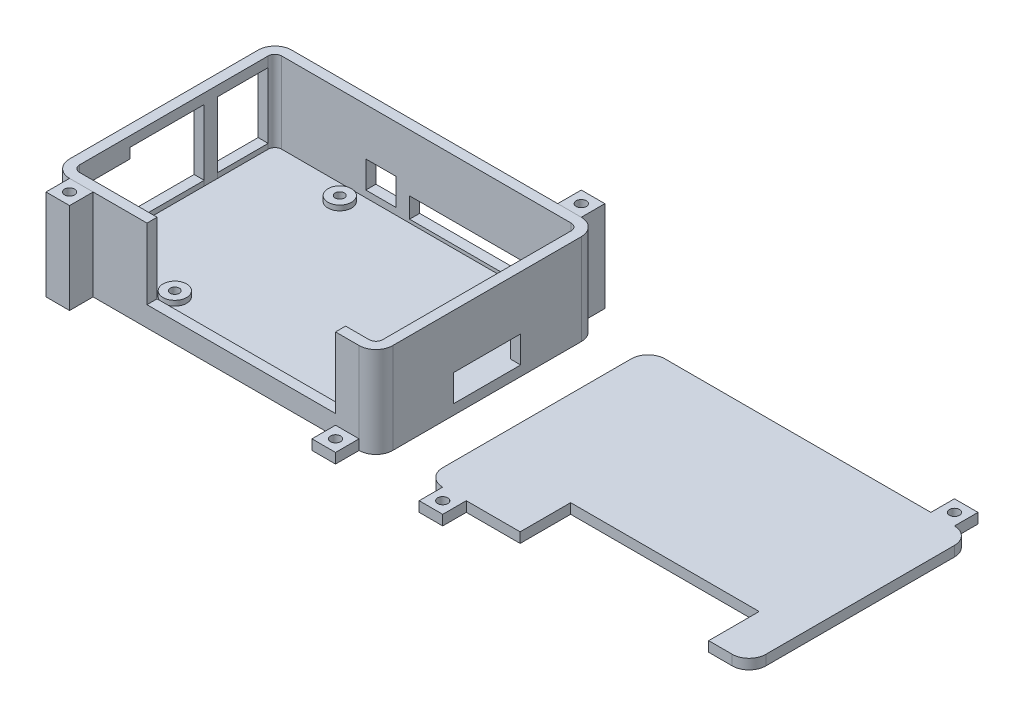
from build123d import *

# Parameters (mm, degrees)
EXTRUIR_L_MINA1_DEPTH      = 24
SALIENTE_EXTRUIR1_START    = 3
SALIENTE_EXTRUIR1_DEPTH    = 3
CORTAR_EXTRUIR1_REACH      = 106.312
CROQUIS4_W                 = 15
CROQUIS4_H                 = 21
CORTAR_EXTRUIR2_REACH      = 87.065
CROQUIS5_W                 = 56
CROQUIS5_H                 = 21
CORTAR_EXTRUIR3_REACH      = 87.065
CROQUIS7_W                 = 41
CROQUIS7_H                 = 6
CROQUIS7_W_2               = 9
CROQUIS7_H_2               = 8
CROQUIS8_W                 = 7
CROQUIS8_H                 = 7
SALIENTE_EXTRUIR5_DEPTH    = 27
SALIENTE_EXTRUIR5_2_DEPTH  = 27
CROQUIS10_R                = 1.5
CORTAR_EXTRUIR4_DEPTH      = 20
CROQUIS11_R                = 1.5
SALIENTE_EXTRUIR6_DEPTH    = 3
CROQUIS12_W                = 15
CROQUIS12_H                = 1.5
SALIENTE_EXTRUIR7_DEPTH    = 3
CROQUIS12_W_2              = 37
SALIENTE_EXTRUIR7_2_DEPTH  = 3
CROQUIS13_R                = 3.5
CROQUIS13_R_2              = 1.35
SALIENTE_EXTRUIR8_DEPTH    = 1.5
CORTAR_EXTRUIR5_DEPTH      = 2
CORTAR_EXTRUIR5_DEPTH_BACK = 166.548420234
CROQUIS14_R                = 1.35
CROQUIS15_W                = 56
CROQUIS15_H                = 15
CORTAR_EXTRUIR6_DEPTH      = 167.009877543
CROQUIS16_W                = 7
CROQUIS16_H                = 7
CROQUIS16_R                = 1.5
SALIENTE_EXTRUIR9_DEPTH    = 3
CROQUIS17_W                = 20
CROQUIS17_H                = 8
CORTAR_EXTRUIR7_DEPTH      = 3


with BuildPart() as part:
    # Croquis1 → Extruir-Lámina1 (new body)
    with BuildSketch(Plane(origin=(0, 0, 0), x_dir=(1, 0, 0), z_dir=(0, 1, 0))):
        with BuildLine():
            Line((-48, 28), (-48, -28))
            ThreePointArc((-48, -28), (-46.535533906, -31.535533906), (-43, -33))
            Line((-43, -33), (43, -33))
            ThreePointArc((43, -33), (46.535533906, -31.535533906), (48, -28))
            Line((48, -28), (48, 28))
            ThreePointArc((48, 28), (46.535533906, 31.535533906), (43, 33))
            Line((43, 33), (-43, 33))
            ThreePointArc((-43, 33), (-46.535533906, 31.535533906), (-48, 28))
        make_face()
        with BuildLine():
            Line((-45, 28), (-45, -28))
            ThreePointArc((-45, -28), (-44.414213562, -29.414213562), (-43, -30))
            Line((-43, -30), (43, -30))
            ThreePointArc((43, -30), (44.414213562, -29.414213562), (45, -28))
            Line((45, -28), (45, 28))
            ThreePointArc((45, 28), (44.414213562, 29.414213562), (43, 30))
            Line((43, 30), (-43, 30))
            ThreePointArc((-43, 30), (-44.414213562, 29.414213562), (-45, 28))
        make_face(mode=Mode.SUBTRACT)
    extrude(amount=EXTRUIR_L_MINA1_DEPTH)

    # Croquis3 → Saliente-Extruir1 (add)
    with BuildSketch(Plane.XZ.offset(SALIENTE_EXTRUIR1_START)):
        with BuildLine():
            Line((-43, 33), (43, 33))
            ThreePointArc((43, 33), (46.535533906, 31.535533906), (48, 28))
            Line((48, 28), (48, -28))
            ThreePointArc((48, -28), (46.535533906, -31.535533906), (43, -33))
            Line((43, -33), (-43, -33))
            ThreePointArc((-43, -33), (-46.535533906, -31.535533906), (-48, -28))
            Line((-48, -28), (-48, 28))
            ThreePointArc((-48, 28), (-46.535533906, 31.535533906), (-43, 33))
        make_face()
    extrude(amount=-SALIENTE_EXTRUIR1_DEPTH)

    # Croquis4 → Cortar-Extruir1 (cut, up to next)
    with BuildSketch(Plane.ZY.offset(48), mode=Mode.PRIVATE) as cortar_extruir1_sk1:
        Polygon((28, 0), (28, 18), (13, 18), (13, 21), (-9, 21), (-9, 0), align=None)
    cortar_extruir1_tool1 = extrude(cortar_extruir1_sk1.sketch, amount=-CORTAR_EXTRUIR1_REACH, mode=Mode.PRIVATE) & part.part
    # Croquis4 → Cortar-Extruir1 (cut, up to next)
    with BuildSketch(Plane.ZY.offset(48), mode=Mode.PRIVATE) as cortar_extruir1_sk2:
        with Locations((-20.5, 10.5)):
            Rectangle(CROQUIS4_W, CROQUIS4_H)
    cortar_extruir1_tool2 = extrude(cortar_extruir1_sk2.sketch, amount=-CORTAR_EXTRUIR1_REACH, mode=Mode.PRIVATE) & part.part
    add(cortar_extruir1_tool1.solids().sort_by_distance((-48, 9.946721, 8.82377))[0], mode=Mode.SUBTRACT)
    add(cortar_extruir1_tool2.solids().sort_by_distance((-48, 10.5, -20.5))[0], mode=Mode.SUBTRACT)

    # Croquis5 → Cortar-Extruir2 (cut, up to next)
    with BuildSketch(Plane.XY.offset(33), mode=Mode.PRIVATE) as cortar_extruir2_sk1:
        with Locations((8, 13.5)):
            Rectangle(CROQUIS5_W, CROQUIS5_H)
    cortar_extruir2_tool1 = extrude(cortar_extruir2_sk1.sketch, amount=-CORTAR_EXTRUIR2_REACH, mode=Mode.PRIVATE) & part.part
    add(cortar_extruir2_tool1.solids().sort_by_distance((8, 13.5, 33))[0], mode=Mode.SUBTRACT)

    # Croquis7 → Cortar-Extruir3 (cut, up to next)
    with BuildSketch(Plane(origin=(0, 0, -33), x_dir=(-1, 0, 0), z_dir=(0, 0, -1)), mode=Mode.PRIVATE) as cortar_extruir3_sk1:
        with Locations((-15.5, 4)):
            Rectangle(CROQUIS7_W, CROQUIS7_H)
    cortar_extruir3_tool1 = extrude(cortar_extruir3_sk1.sketch, amount=-CORTAR_EXTRUIR3_REACH, mode=Mode.PRIVATE) & part.part
    # Croquis7 → Cortar-Extruir3 (cut, up to next)
    with BuildSketch(Plane(origin=(0, 0, -33), x_dir=(-1, 0, 0), z_dir=(0, 0, -1)), mode=Mode.PRIVATE) as cortar_extruir3_sk2:
        with Locations((13.5, 6)):
            Rectangle(CROQUIS7_W_2, CROQUIS7_H_2)
    cortar_extruir3_tool2 = extrude(cortar_extruir3_sk2.sketch, amount=-CORTAR_EXTRUIR3_REACH, mode=Mode.PRIVATE) & part.part
    add(cortar_extruir3_tool1.solids().sort_by_distance((15.5, 4, -33))[0], mode=Mode.SUBTRACT)
    add(cortar_extruir3_tool2.solids().sort_by_distance((-13.5, 6, -33))[0], mode=Mode.SUBTRACT)

    # Croquis13 → Saliente-Extruir8 (add)
    # profile 1 of 4: a face of its own
    with BuildSketch(Plane(origin=(0, 0, 0), x_dir=(1, 0, 0), z_dir=(0, 1, 0))):
        with Locations(Location((-20.97, 25.23, 0), (0, 0, 90))):
            Circle(CROQUIS13_R)
        with Locations(Location((-20.97, 25.23, 0), (0, 0, 270))):
            Circle(CROQUIS13_R_2, mode=Mode.SUBTRACT)
    # profile 2 of 4: a face of its own
    with BuildSketch(Plane(origin=(0, 0, 0), x_dir=(1, 0, 0), z_dir=(0, 1, 0))):
        with Locations(Location((37.03, -23.77, 0), (0, 0, 90))):
            Circle(CROQUIS13_R)
        with Locations(Location((37.03, -23.77, 0), (0, 0, 270))):
            Circle(CROQUIS13_R_2, mode=Mode.SUBTRACT)
    # profile 3 of 4: a face of its own
    with BuildSketch(Plane(origin=(0, 0, 0), x_dir=(1, 0, 0), z_dir=(0, 1, 0))):
        with Locations(Location((-20.97, -23.77, 0), (0, 0, 90))):
            Circle(CROQUIS13_R)
        with Locations(Location((-20.97, -23.77, 0), (0, 0, 270))):
            Circle(CROQUIS13_R_2, mode=Mode.SUBTRACT)
    # profile 4 of 4: a face of its own
    with BuildSketch(Plane(origin=(0, 0, 0), x_dir=(1, 0, 0), z_dir=(0, 1, 0))):
        with Locations(Location((37.03, 25.23, 0), (0, 0, 90))):
            Circle(CROQUIS13_R)
        with Locations(Location((37.03, 25.23, 0), (0, 0, 270))):
            Circle(CROQUIS13_R_2, mode=Mode.SUBTRACT)
    extrude(amount=SALIENTE_EXTRUIR8_DEPTH)

    # Croquis14 → Cortar-Extruir5 (cut, two sides: drawn at the far end of the back side and taken through both)
    with BuildSketch(Plane(origin=(0, 0, 0), x_dir=(1, 0, 0), z_dir=(0, 1, 0)).offset(-CORTAR_EXTRUIR5_DEPTH_BACK)):
        with Locations(Location((37.03, -23.77, 0), (0, 0, 270))):
            Circle(CROQUIS14_R)
        with Locations(Location((-20.97, -23.77, 0), (0, 0, 270))):
            Circle(CROQUIS14_R)
        with Locations(Location((37.03, 25.23, 0), (0, 0, 270))):
            Circle(CROQUIS14_R)
        with Locations(Location((-20.97, 25.23, 0), (0, 0, 270))):
            Circle(CROQUIS14_R)
    extrude(amount=CORTAR_EXTRUIR5_DEPTH + CORTAR_EXTRUIR5_DEPTH_BACK, mode=Mode.SUBTRACT)

    # Croquis16 → Saliente-Extruir9 (add)
    # profile 1 of 2: a face of its own
    with BuildSketch(Plane(origin=(0, 0, 0), x_dir=(1, 0, 0), z_dir=(0, 1, 0))):
        with Locations((-39.5, 36.5)):
            Rectangle(CROQUIS16_W, CROQUIS16_H)
        with Locations(Location((-39.5, 36.5, 0), (0, 0, 270))):
            Circle(CROQUIS16_R, mode=Mode.SUBTRACT)
    # profile 2 of 2: a face of its own
    with BuildSketch(Plane(origin=(0, 0, 0), x_dir=(1, 0, 0), z_dir=(0, 1, 0))):
        with Locations((39.5, -36.5)):
            Rectangle(CROQUIS16_W, CROQUIS16_H)
        with Locations(Location((39.5, -36.5, 0), (0, 0, 270))):
            Circle(CROQUIS16_R, mode=Mode.SUBTRACT)
    extrude(amount=-SALIENTE_EXTRUIR9_DEPTH)

    # Croquis17 → Cortar-Extruir7 (cut)
    with BuildSketch(Plane(origin=(48, 0, 0), x_dir=(0, 0, -1), z_dir=(1, 0, 0))):
        with Locations((0, 4)):
            Rectangle(CROQUIS17_W, CROQUIS17_H)
    extrude(amount=-CORTAR_EXTRUIR7_DEPTH, mode=Mode.SUBTRACT)


with BuildPart() as body_2:
    # Croquis8 → Saliente-Extruir5 (new body)
    with BuildSketch(Plane(origin=(0, 24, 0), x_dir=(1, 0, 0), z_dir=(0, 1, 0))):
        with Locations((-39.5, -36.5)):
            Rectangle(CROQUIS8_W, CROQUIS8_H)
    extrude(amount=-SALIENTE_EXTRUIR5_DEPTH)


with BuildPart() as body_3:
    # Croquis8 → Saliente-Extruir5 2 (new body)
    with BuildSketch(Plane(origin=(0, 24, 0), x_dir=(1, 0, 0), z_dir=(0, 1, 0))):
        with Locations((39.5, 36.5)):
            Rectangle(CROQUIS8_W, CROQUIS8_H)
    extrude(amount=-SALIENTE_EXTRUIR5_2_DEPTH)


with BuildPart() as cortar_extruir4_tool:
    # Croquis10 → Cortar-Extruir4 (new body)
    with BuildSketch(Plane(origin=(0, 24, 0), x_dir=(1, 0, 0), z_dir=(0, 1, 0))):
        with Locations(Location((-39.5, -36.5, 0), (0, 0, 270))):
            Circle(CROQUIS10_R)
        with Locations(Location((39.5, 36.5, 0), (0, 0, 270))):
            Circle(CROQUIS10_R)
    extrude(amount=-CORTAR_EXTRUIR4_DEPTH)


with BuildPart() as body_2_1:
    add(body_2.part)

    # Cortar-Extruir4: cut by cortar_extruir4_tool
    add(cortar_extruir4_tool.part, mode=Mode.SUBTRACT)


with BuildPart() as body_3_1:
    add(body_3.part)

    # Cortar-Extruir4: cut by cortar_extruir4_tool
    add(cortar_extruir4_tool.part, mode=Mode.SUBTRACT)


with BuildPart() as body_4:
    # Croquis11 → Saliente-Extruir6 (new body)
    with BuildSketch(Plane(origin=(0, 0, 0), x_dir=(1, 0, 0), z_dir=(0, 1, 0))):
        with BuildLine():
            Line((67.84042131, -33), (67.84042131, -40))
            Line((67.84042131, -40), (74.84042131, -40))
            Line((74.84042131, -40), (74.84042131, -33))
            Line((74.84042131, -33), (150.84042131, -33))
            Line((150.84042131, -33), (153.84042131, -33))
            ThreePointArc((153.84042131, -33), (157.375955216, -31.535533906), (158.84042131, -28))
            Line((158.84042131, -28), (158.84042131, 28))
            ThreePointArc((158.84042131, 28), (157.375955216, 31.535533906), (153.84042131, 33))
            Line((153.84042131, 33), (153.84042131, 40))
            Line((153.84042131, 40), (146.84042131, 40))
            Line((146.84042131, 40), (146.84042131, 33))
            Line((146.84042131, 33), (67.84042131, 33))
            ThreePointArc((67.84042131, 33), (64.304887404, 31.535533906), (62.84042131, 28))
            Line((62.84042131, 28), (62.84042131, -28))
            ThreePointArc((62.84042131, -28), (64.304887404, -31.535533906), (67.84042131, -33))
        make_face()
        with Locations(Location((71.34042131, -36.5, 0), (0, 0, 270))):
            Circle(CROQUIS11_R, mode=Mode.SUBTRACT)
        with Locations(Location((150.34042131, 36.5, 0), (0, 0, 270))):
            Circle(CROQUIS11_R, mode=Mode.SUBTRACT)
    extrude(amount=-SALIENTE_EXTRUIR6_DEPTH)

    # Croquis15 → Cortar-Extruir6 (cut, through all)
    with BuildSketch(Plane(origin=(0, -3, 0), x_dir=(-1, 0, 0), z_dir=(0, -1, 0))):
        with Locations((-118.84042131, -25.5)):
            Rectangle(CROQUIS15_W, CROQUIS15_H)
    extrude(amount=-CORTAR_EXTRUIR6_DEPTH, mode=Mode.SUBTRACT)


with BuildPart() as body_5:
    # Croquis12 → Saliente-Extruir7 (new body)
    with BuildSketch(Plane.ZY.offset(48)):
        with Locations((-20.5, 0.75)):
            Rectangle(CROQUIS12_W, CROQUIS12_H)
    extrude(amount=-SALIENTE_EXTRUIR7_DEPTH)


with BuildPart() as body_6:
    # Croquis12 → Saliente-Extruir7 2 (new body)
    with BuildSketch(Plane.ZY.offset(48)):
        with Locations((9.5, 0.75)):
            Rectangle(CROQUIS12_W_2, CROQUIS12_H)
    extrude(amount=-SALIENTE_EXTRUIR7_2_DEPTH)


solid = Compound([part.part, body_2_1.part, body_3_1.part, body_4.part, body_5.part, body_6.part])
